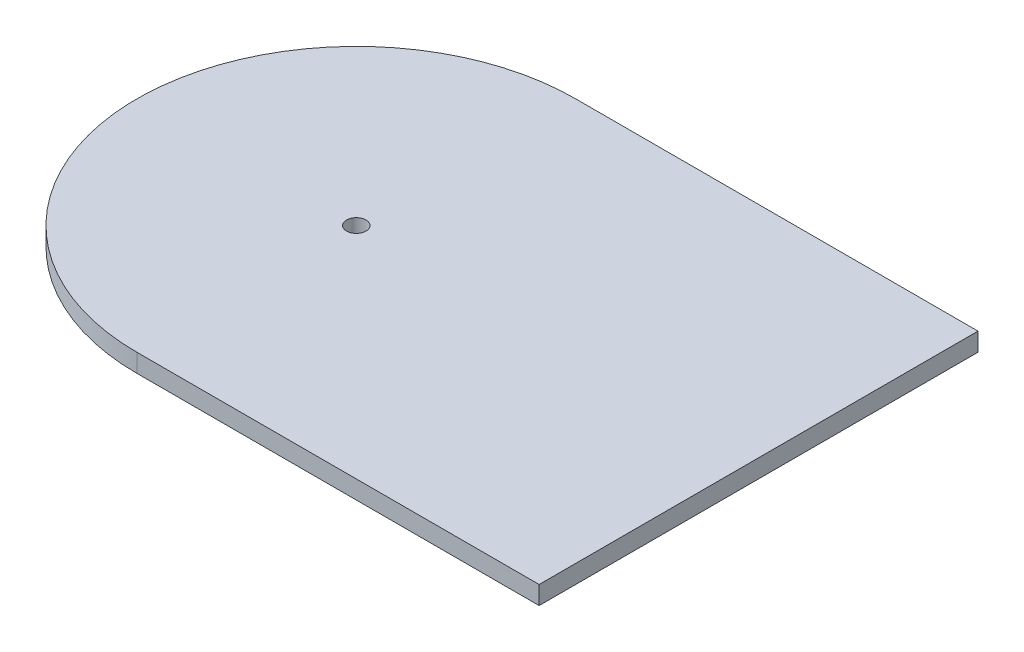
from build123d import *

# Parameters (mm, degrees)
BOSS_EXTRUDE1_DEPTH = 6.35


with BuildPart() as part:
    # Sketch1 → Boss-Extrude1 (new body)
    with BuildSketch(Plane(origin=(0, 0, 0), x_dir=(1, 0, 0), z_dir=(0, 1, 0))):
        with BuildLine():
            ThreePointArc((0, 76.2), (-76.2, 0), (0, -76.2))
            Line((0, -76.2), (0, -3.3655))
            ThreePointArc((0, -3.3655), (-3.3655, 0), (0, 3.3655))
            Line((0, 3.3655), (0, 76.2))
        make_face()
        with BuildLine():
            Line((0, -3.3655), (0, -76.2))
            ThreePointArc((0, -76.2), (53.881536726, -53.881536726), (76.2, 0))
            ThreePointArc((76.2, 0), (53.881536726, 53.881536726), (0, 76.2))
            Line((0, 76.2), (0, 3.3655))
            ThreePointArc((0, 3.3655), (2.379767872, 2.379767872), (3.3655, 0))
            ThreePointArc((3.3655, 0), (2.379767872, -2.379767872), (0, -3.3655))
        make_face()
        with BuildLine():
            ThreePointArc((76.2, 0), (53.881536726, -53.881536726), (0, -76.2))
            Line((0, -76.2), (139.7, -76.2))
            Line((139.7, -76.2), (139.7, 76.2))
            Line((139.7, 76.2), (0, 76.2))
            ThreePointArc((0, 76.2), (53.881536726, 53.881536726), (76.2, 0))
        make_face()
    extrude(amount=BOSS_EXTRUDE1_DEPTH)


solid = part.part
